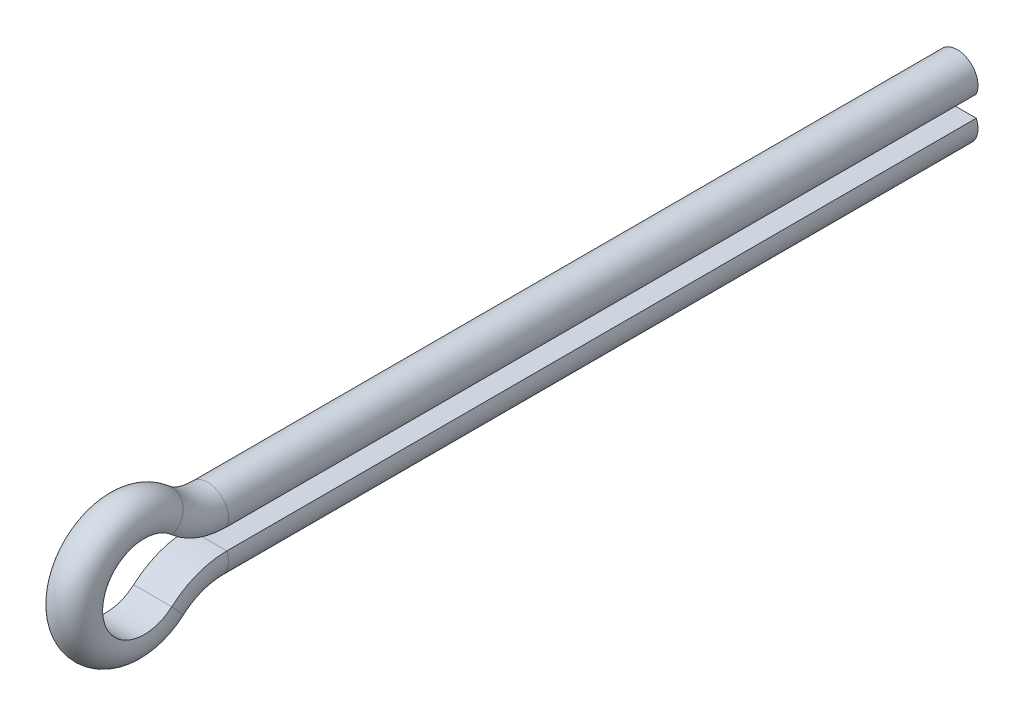
from build123d import *


with BuildPart() as part:
    # Sweep10: sweep along a path in Sketch6
    with BuildLine(Plane(origin=(0, 0, 0), x_dir=(0, 0, -1), z_dir=(1, 0, 0))) as sweep10_path:
        Line((0, 2.5), (-90.078432584, 2.5))
        ThreePointArc((-90.078432584, 2.5), (-93.613966489, 3.145856533), (-96.692810861, 5))
        ThreePointArc((-96.692810861, 5), (-105, 1.25), (-96.692810861, -2.5))
        ThreePointArc((-96.692810861, -2.5), (-93.613966489, -0.645856533), (-90.078432584, 0))
        Line((-90.078432584, 0), (0, 0))
    # Sketch4 → Sweep10 (sweep)
    with BuildSketch(Plane.XY):
        with BuildLine():
            Line((-2.291287847, 0), (2.291287847, 0))
            ThreePointArc((2.291287847, 0), (0, -3.5), (-2.291287847, 0))
        make_face()
    sweep(path=sweep10_path.line)


solid = part.part
